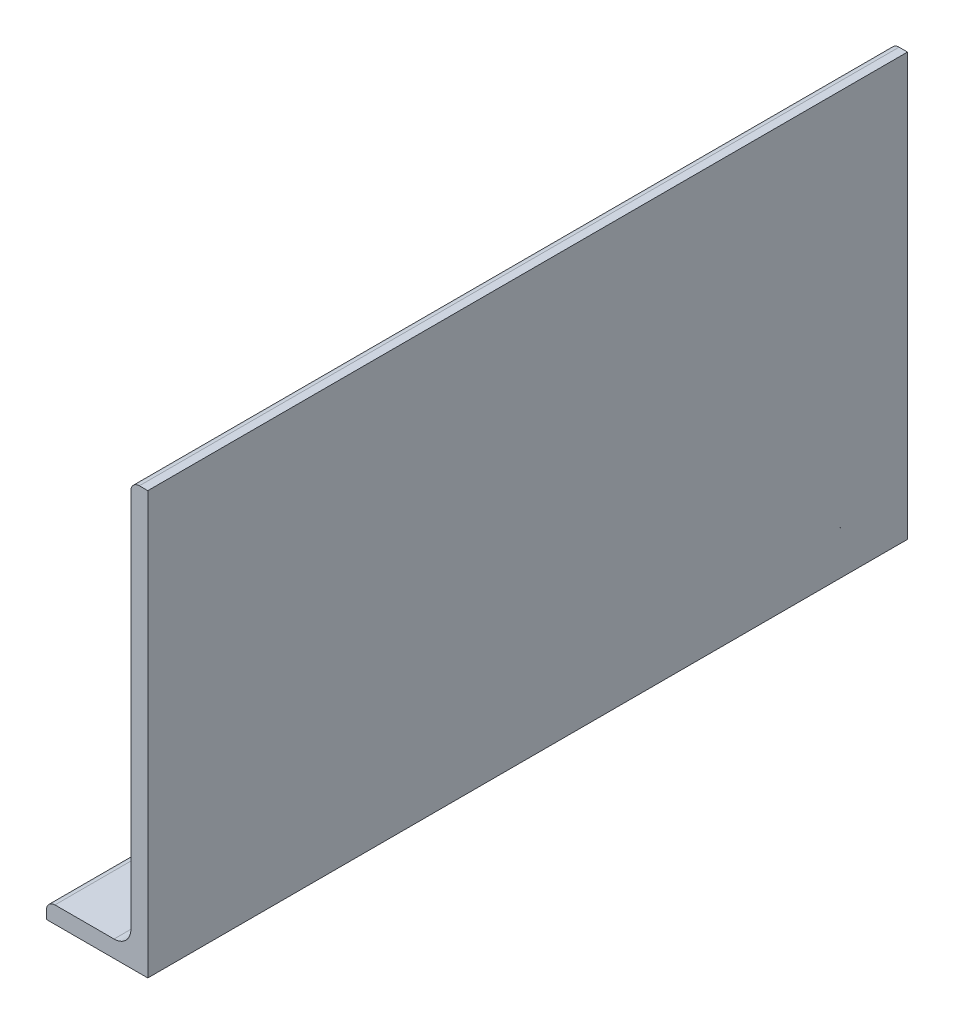
from build123d import *

# Parameters (mm, degrees)
BOSS_EXTRUDE1_DEPTH = 90
FILLET1_R           = 1
FILLET2_R           = 2
SKETCH2_R           = 1.6
CUT_EXTRUDE1_DEPTH  = 10


with BuildPart() as part:
    # Sketch1 → Boss-Extrude1 (new body)
    with BuildSketch(Plane.XY):
        Polygon((1262.507506827, -206.048661528), (1262.507506827, -256.048661528), (1250.507506827, -256.048661528), (1250.507506827, -254.048661528), (1260.507506827, -254.048661528), (1260.507506827, -206.048661528), align=None)
    extrude(amount=BOSS_EXTRUDE1_DEPTH)

    # Fillet1
    fillet1_edges = [part.edges().sort_by_distance(p)[0] for p in [
        (1250.507506827, -254.048661528, 45),
        (1260.507506827, -206.048661528, 45),
    ]]
    fillet(fillet1_edges, radius=FILLET1_R)

    # Fillet2
    fillet2_edges = [part.edges().sort_by_distance(p)[0] for p in [
        (1260.507506827, -254.048661528, 45),
    ]]
    fillet(fillet2_edges, radius=FILLET2_R)

    # Sketch2 → Cut-Extrude1 (cut)
    with BuildSketch(Plane(origin=(0, -254.048661528, 0), x_dir=(1, 0, 0), z_dir=(0, 1, 0))):
        with Locations(Location((1255.007506827, -70, 0), (0, 0, 270))):
            Circle(SKETCH2_R)
        with Locations(Location((1255.007506827, -20, 0), (0, 0, 270))):
            Circle(SKETCH2_R)
    extrude(amount=-CUT_EXTRUDE1_DEPTH, mode=Mode.SUBTRACT)


solid = part.part
